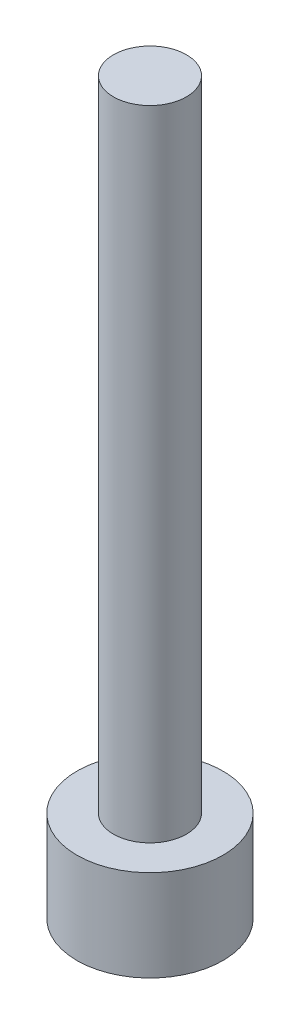
from build123d import *

# Parameters (mm, degrees)
SKETCH1_R           = 4
BOSS_EXTRUDE2_DEPTH = 5
SKETCH2_R           = 2
BOSS_EXTRUDE3_DEPTH = 35


with BuildPart() as part:
    # Sketch1 → Boss-Extrude2 (new body)
    with BuildSketch(Plane(origin=(0, 0, 0), x_dir=(1, 0, 0), z_dir=(0, 1, 0))):
        with Locations(Location((0, 0, 0), (0, 0, 270))):
            Circle(SKETCH1_R)
    extrude(amount=BOSS_EXTRUDE2_DEPTH)

    # Sketch2 → Boss-Extrude3 (add)
    with BuildSketch(Plane(origin=(0, 5, 0), x_dir=(1, 0, 0), z_dir=(0, 1, 0))):
        with Locations(Location((0, 0, 0), (0, 0, 270))):
            Circle(SKETCH2_R)
    extrude(amount=BOSS_EXTRUDE3_DEPTH)


solid = part.part
